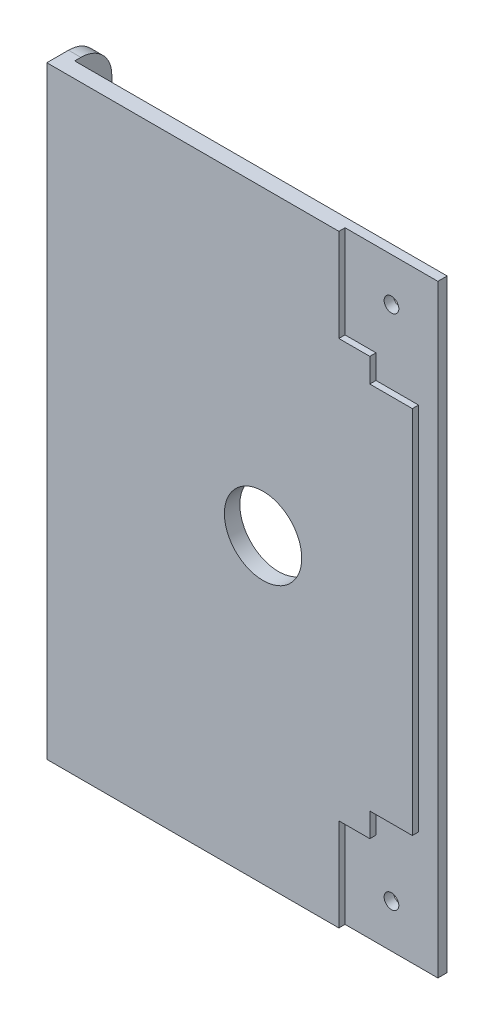
from build123d import *

# Parameters (mm, degrees)
CROQUIS1_W                  = 248.76
CROQUIS1_H                  = 195
SALIENTE_EXTRUIR1_DEPTH     = 5
CROQUIS2_W                  = 48
CROQUIS2_H                  = 30
CROQUIS2_W_2                = 30
CORTAR_EXTRUIR1_DEPTH       = 2
CROQUIS3_R                  = 2.375
CORTAR_EXTRUIR2_DEPTH       = 10
CROQUIS4_R                  = 40
SALIENTE_EXTRUIR2_DEPTH     = 206
CROQUIS5_R                  = 12.5
CORTAR_EXTRUIR3_DEPTH       = 10
CROQUIS12_W                 = 12
CROQUIS12_H                 = 30
SALIENTE_EXTRUIR3_DEPTH     = 4
REDONDEO1_R                 = 10
REDONDEO2_R                 = 10
REDONDEO3_R                 = 10
CORTAR_EXTRUIR5_DEPTH       = 262.677217236
CORTAR_EXTRUIR5_DEPTH_BACK  = 262.677217236
CROQUIS13_R                 = 1.625
CORTAR_EXTRUIR7_DEPTH       = 2
CROQUIS16_R                 = 1.75
CORTAR_EXTRUIR9_DEPTH       = 20
CORTAR_EXTRUIR16_DEPTH      = 264.206105047
CORTAR_EXTRUIR16_DEPTH_BACK = 264.206105047
CROQUIS14_W                 = 124.38
CROQUIS14_H                 = 195


with BuildPart() as part:
    # Croquis1 → Saliente-Extruir1 (new body)
    with BuildSketch(Plane.XY):
        with Locations((7.088293187, 0.26268)):
            Rectangle(CROQUIS1_W, CROQUIS1_H)
    extrude(amount=SALIENTE_EXTRUIR1_DEPTH)

    # Croquis2 → Cortar-Extruir1 (cut)
    with BuildSketch(Plane.XY.offset(5)):
        with Locations((-93.291706813, -82.23732)):
            Rectangle(CROQUIS2_W, CROQUIS2_H)
        with Locations((116.468293187, 82.76268)):
            Rectangle(CROQUIS2_W_2, CROQUIS2_H)
        with Locations((116.468293187, -82.23732)):
            Rectangle(CROQUIS2_W_2, CROQUIS2_H)
        with Locations((-93.291706813, 82.76268)):
            Rectangle(CROQUIS2_W, CROQUIS2_H)
    extrude(amount=-CORTAR_EXTRUIR1_DEPTH, mode=Mode.SUBTRACT)

    # Croquis3 → Cortar-Extruir2 (cut)
    with BuildSketch(Plane.XY.offset(5)):
        with Locations((-93.291706813, 83.76268)):
            Circle(CROQUIS3_R)
        with Locations((-93.291706813, -83.23732)):
            Circle(CROQUIS3_R)
        with Locations((116.468293187, 83.76268)):
            Circle(CROQUIS3_R)
        with Locations((116.468293187, -83.23732)):
            Circle(CROQUIS3_R)
    extrude(amount=-CORTAR_EXTRUIR2_DEPTH, mode=Mode.SUBTRACT)

    # Croquis4 → Saliente-Extruir2 (add)
    with BuildSketch(Plane(origin=(0, 0, 0), x_dir=(-1, 0, 0), z_dir=(0, 0, -1))):
        with Locations(Location((55.101706813, 0.26268, 0), (0, 0, 180))):
            Circle(CROQUIS4_R)
    extrude(amount=SALIENTE_EXTRUIR2_DEPTH)

    # Croquis5 → Cortar-Extruir3 (cut)
    with BuildSketch(Plane(origin=(0, 0, 0), x_dir=(-1, 0, 0), z_dir=(0, 0, -1))):
        with Locations((-76.968293187, 0.26268)):
            Circle(CROQUIS5_R)
    extrude(amount=-CORTAR_EXTRUIR3_DEPTH, mode=Mode.SUBTRACT)

    # Croquis12 → Saliente-Extruir3 (add, symmetric)
    with BuildSketch(Plane(origin=(7.088293187, 0, 0), x_dir=(0, 0, -1), z_dir=(1, 0, 0))):
        with Locations((6, 82.76268)):
            Rectangle(CROQUIS12_W, CROQUIS12_H)
        with Locations((6, -82.23732)):
            Rectangle(CROQUIS12_W, CROQUIS12_H)
    extrude(amount=SALIENTE_EXTRUIR3_DEPTH, both=True)

    # Redondeo1
    redondeo1_edges = [part.edges().sort_by_distance(p)[0] for p in [
        (7.088293187, 67.76268, 0),
        (7.088293187, -67.23732, 0),
    ]]
    fillet(redondeo1_edges, radius=REDONDEO1_R)

    # Redondeo2
    redondeo2_edges = [part.edges().sort_by_distance(p)[0] for p in [
        (7.088293187, 67.76268, -12),
        (7.088293187, -67.23732, -12),
    ]]
    fillet(redondeo2_edges, radius=REDONDEO2_R)

    # Redondeo3
    redondeo3_edges = [part.edges().sort_by_distance(p)[0] for p in [
        (7.088293187, 97.76268, -12),
        (7.088293187, -97.23732, -12),
    ]]
    fillet(redondeo3_edges, radius=REDONDEO3_R)

    # Croquis13 → Cortar-Extruir5 (cut, two sides: drawn at the far end of the back side and taken through both)
    with BuildSketch(Plane(origin=(11.088293187, 0, 0), x_dir=(0, 0, -1), z_dir=(1, 0, 0)).offset(-CORTAR_EXTRUIR5_DEPTH_BACK)):
        with Locations(Location((6, 87.76268, 0), (0, 0, 90))):
            Circle(CROQUIS13_R)
        with Locations(Location((6, 77.76268, 0), (0, 0, 90))):
            Circle(CROQUIS13_R)
        with Locations(Location((6, -77.23732, 0), (0, 0, 90))):
            Circle(CROQUIS13_R)
        with Locations(Location((6, -87.23732, 0), (0, 0, 90))):
            Circle(CROQUIS13_R)
    extrude(amount=CORTAR_EXTRUIR5_DEPTH + CORTAR_EXTRUIR5_DEPTH_BACK, mode=Mode.SUBTRACT)

    # Croquis15 → Cortar-Extruir7 (cut)
    with BuildSketch(Plane.XY.offset(5)):
        Polygon((111.468293187, 67.76268), (131.468293187, 67.76268), (131.468293187, -67.23732), (111.468293187, -67.23732), (111.468293187, -59.48732), (125.218293187, -59.48732), (125.218293187, 60.01268), (111.468293187, 60.01268), align=None)
    extrude(amount=-CORTAR_EXTRUIR7_DEPTH, mode=Mode.SUBTRACT)

    # Croquis16 → Cortar-Extruir9 (cut)
    with BuildSketch(Plane.XY.offset(5)):
        with Locations((-55.101706813, 20.26268)):
            Circle(CROQUIS16_R)
        with Locations((-35.101706813, 0.26268)):
            Circle(CROQUIS16_R)
        with Locations((-55.101706813, -19.73732)):
            Circle(CROQUIS16_R)
        with Locations((-75.101706813, 0.26268)):
            Circle(CROQUIS16_R)
    extrude(amount=-CORTAR_EXTRUIR9_DEPTH, mode=Mode.SUBTRACT)

    # Croquis14 → Cortar-Extruir16 (cut, two sides: drawn at the far end of the back side and taken through both)
    with BuildSketch(Plane(origin=(0, 0, 0), x_dir=(-1, 0, 0), z_dir=(0, 0, -1)).offset(-CORTAR_EXTRUIR16_DEPTH_BACK)):
        with Locations((55.101706813, 0.26268)):
            Rectangle(CROQUIS14_W, CROQUIS14_H)
    extrude(amount=CORTAR_EXTRUIR16_DEPTH + CORTAR_EXTRUIR16_DEPTH_BACK, mode=Mode.SUBTRACT)


solid = part.part
